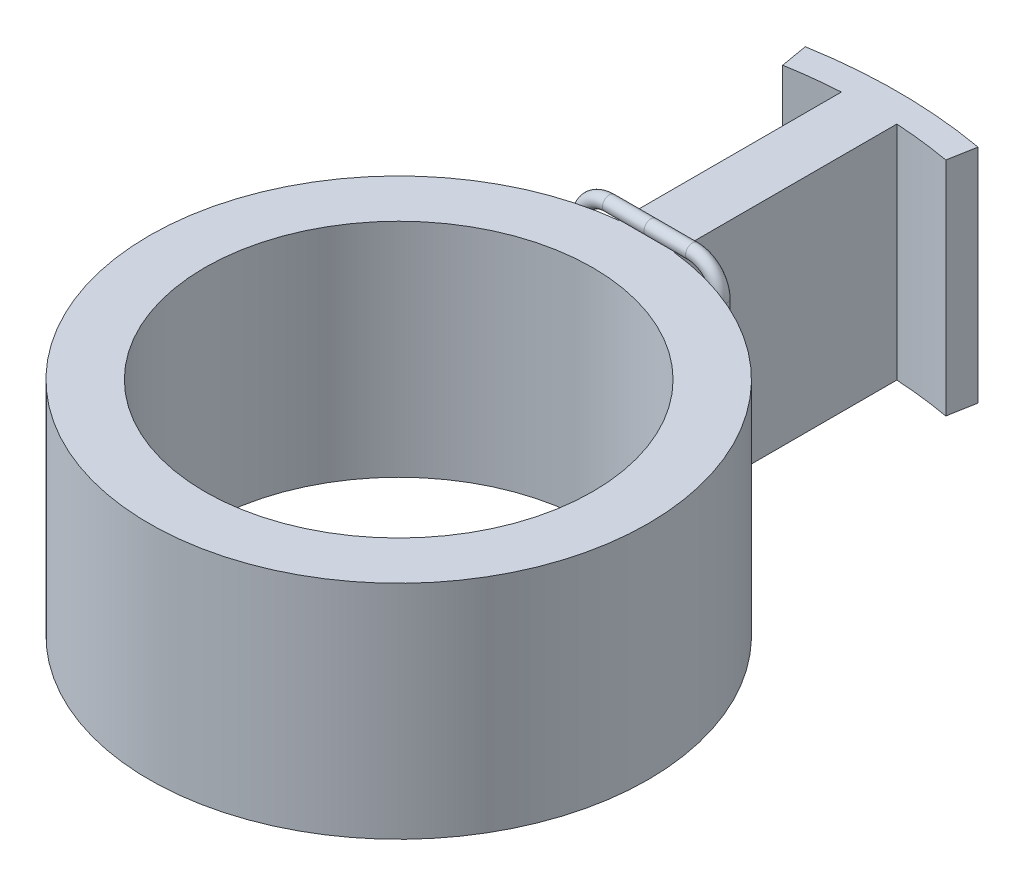
from build123d import *

# Parameters (mm, degrees)
SKETCH1_R           = 70
BOSS_EXTRUDE1_DEPTH = 80
BOSS_EXTRUDE2_DEPTH = 80
SKETCH3_R           = 2.5


with BuildPart() as part:
    # Sketch1 → Boss-Extrude1 (new body)
    with BuildSketch(Plane(origin=(0, 0, 0), x_dir=(1, 0, 0), z_dir=(0, 1, 0))):
        with BuildLine():
            ThreePointArc((10, 89.4427191), (0, 90), (-10, 89.4427191))
            ThreePointArc((-10, 89.4427191), (-60, -67.082039325), (90, 0))
            ThreePointArc((90, 0), (67.082039325, 60), (10, 89.4427191))
        make_face()
        Circle(SKETCH1_R, mode=Mode.SUBTRACT)
    extrude(amount=BOSS_EXTRUDE1_DEPTH)

    # Sketch1<3> → Boss-Extrude2 (add)
    with BuildSketch(Plane(origin=(0, 0, 0), x_dir=(1, 0, 0), z_dir=(0, 1, 0))):
        with BuildLine():
            ThreePointArc((31.838312344, 177.161852178), (0.590784056, 179.999030481), (-30.674694906, 177.367029327))
            Line((-30.674694906, 177.367029327), (-28.970545189, 167.513305476))
            ThreePointArc((-28.970545189, 167.513305476), (-19.516080985, 168.876056867), (-10, 169.705627485))
            Line((-10, 169.705627485), (-10, 89.4427191))
            ThreePointArc((-10, 89.4427191), (0, 90), (10, 89.4427191))
            Line((10, 89.4427191), (10, 169.705627485))
            ThreePointArc((10, 169.705627485), (20.070249656, 168.811092878), (30.069517214, 167.319527057))
            Line((30.069517214, 167.319527057), (31.838312344, 177.161852178))
        make_face()
    extrude(amount=BOSS_EXTRUDE2_DEPTH)

    # Sweep1: sweep along a path in Sketch2
    with BuildLine(Plane.XY.offset(-91)) as sweep1_path:
        Line((15, -2.25), (-15, -2.25))
        ThreePointArc((-15, -2.25), (-22.071067812, 0.678932188), (-25, 7.75))
        Line((-25, 7.75), (-25, 72.25))
        ThreePointArc((-25, 72.25), (-22.071067812, 79.321067812), (-15, 82.25))
        Line((-15, 82.25), (15, 82.25))
        ThreePointArc((15, 82.25), (22.071067812, 79.321067812), (25, 72.25))
        Line((25, 72.25), (25, 7.75))
        ThreePointArc((25, 7.75), (22.071067812, 0.678932188), (15, -2.25))
    # Sketch3 → Sweep1 (sweep)
    with BuildSketch(Plane(origin=(0, 0, 0), x_dir=(0, 0, -1), z_dir=(1, 0, 0))):
        with Locations((91, 82.25)):
            Circle(SKETCH3_R)
    sweep(path=sweep1_path.line)


solid = part.part
